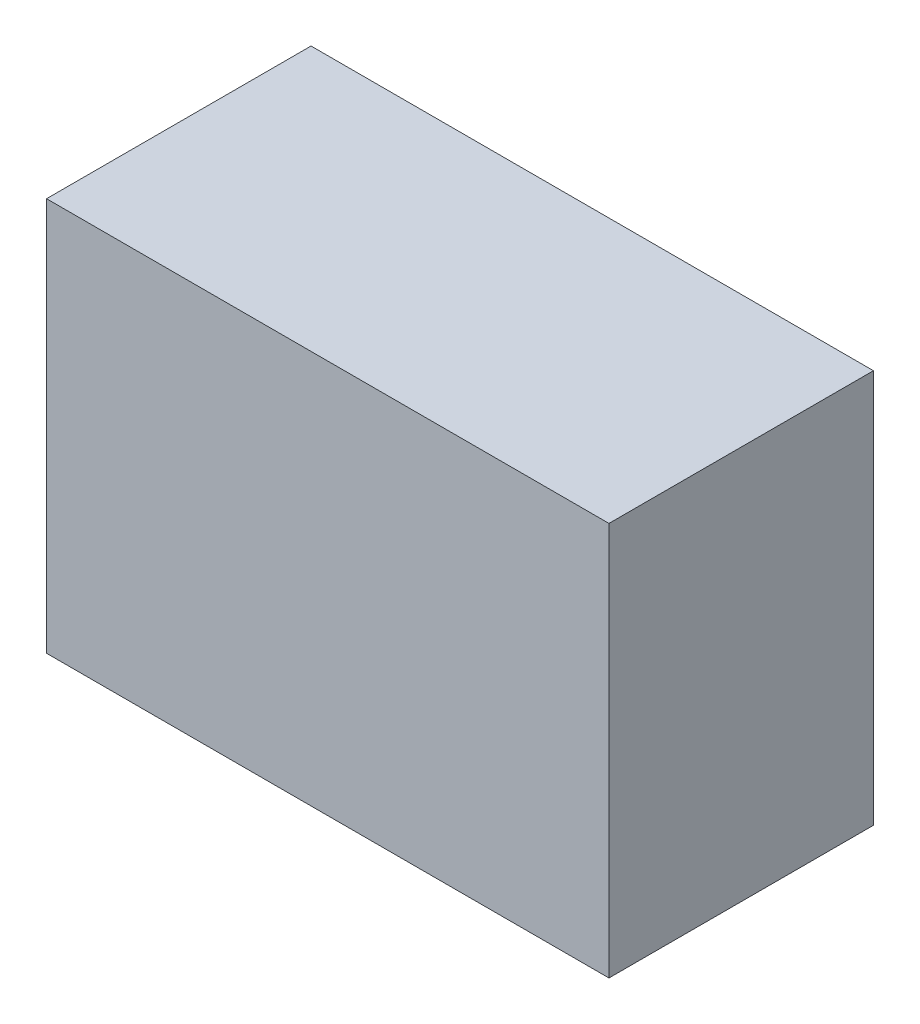
from build123d import *

# Parameters (mm, degrees)
SKETCH1_W           = 100
SKETCH1_H           = 70
BOSS_EXTRUDE1_DEPTH = 47.0258


with BuildPart() as part:
    # Sketch1 → Boss-Extrude1 (new body)
    with BuildSketch(Plane.XY):
        with Locations((-50, 35)):
            Rectangle(SKETCH1_W, SKETCH1_H)
    extrude(amount=BOSS_EXTRUDE1_DEPTH)


solid = part.part
